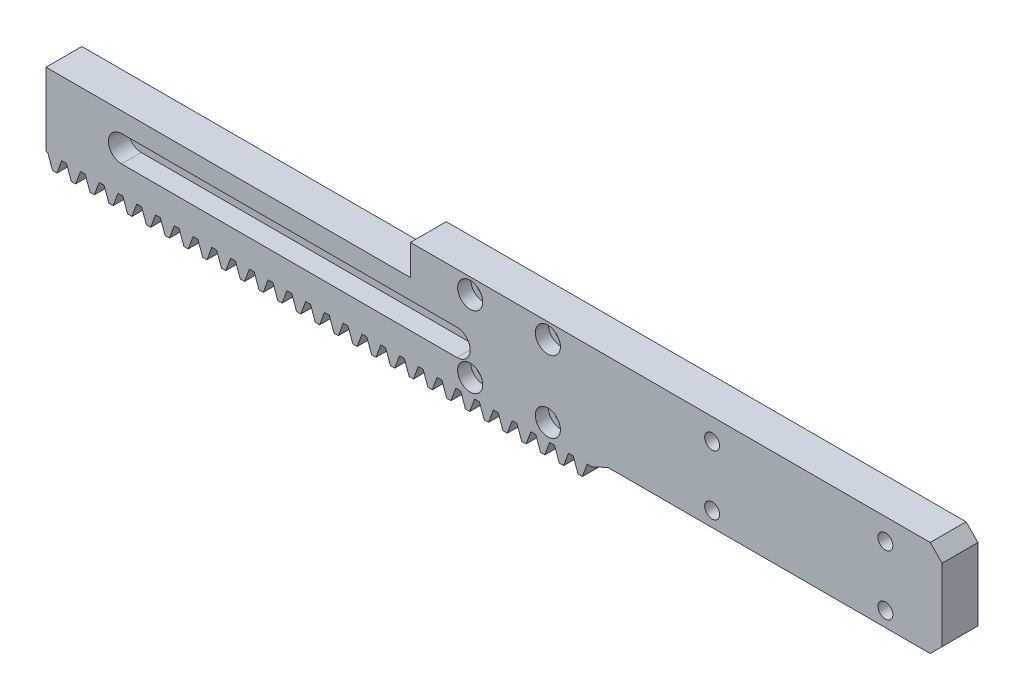
from build123d import *

# Parameters (mm, degrees)
MODULE_START                                   = 40.4
MODULE_1_RACK_WITH_VERTICAL_CARRIER_TAIL_DEPTH = 6
MGN7H_START                                    = 40.4
MGN7H_CARRIAGE_FIXING_PAD_PROFILE_W            = 33
MGN7H_CARRIAGE_FIXING_PAD_PROFILE_H            = 6.1
MGN7H_CARRIAGE_FIXING_PAD_DEPTH                = 6
FULL_START                                     = 43.1
FULL_STROKE_LIMIT_SLOT_56_55_MM_DEPTH          = 3.4
RADAR_START                                    = 40.3
RADAR_SEAT_FOUR_M3_PILOTS_29_X_10_MM_PRO_R     = 1.25
RADAR_SEAT_FOUR_M3_PILOTS_29_X_10_MM_DEPTH     = 6.2
MGN7H_START_2                                  = 40.3
MGN7H_FOUR_M2_CLEARANCES_13_X_12_MM_PROF_R     = 1.1
MGN7H_FOUR_M2_CLEARANCES_13_X_12_MM_DEPTH      = 6.2
MGN7H_START_3                                  = 44.2
MGN7H_M2_HEAD_POCKETS_PROFILE_R                = 2.1
MGN7H_M2_HEAD_POCKETS_DEPTH                    = 2.3


with BuildPart() as part:
    # Module 1 rack with vertical carrier  2 → Module 1 rack with vertical carrier tail (new body)
    with BuildSketch(Plane.XY.offset(MODULE_START)):
        Polygon((-69, 10.26), (-68.713242711, 10.26), (-67.908868493, 8.05), (-67.179615611, 8.05), (-66.375241394, 10.26), (-65.571650057, 10.26), (-64.767275839, 8.05), (-64.038022958, 8.05), (-63.23364874, 10.26), (-62.430057404, 10.26), (-61.625683186, 8.05), (-60.896430304, 8.05), (-60.092056086, 10.26), (-59.28846475, 10.26), (-58.484090532, 8.05), (-57.754837651, 8.05), (-56.950463433, 10.26), (-56.146872096, 10.26), (-55.342497879, 8.05), (-54.613244997, 8.05), (-53.808870779, 10.26), (-53.005279443, 10.26), (-52.200905225, 8.05), (-51.471652343, 8.05), (-50.667278126, 10.26), (-49.863686789, 10.26), (-49.059312572, 8.05), (-48.33005969, 8.05), (-47.525685472, 10.26), (-46.722094136, 10.26), (-45.917719918, 8.05), (-45.188467036, 8.05), (-44.384092819, 10.26), (-43.580501482, 10.26), (-42.776127264, 8.05), (-42.046874383, 8.05), (-41.242500165, 10.26), (-40.438908828, 10.26), (-39.634534611, 8.05), (-38.905281729, 8.05), (-38.100907511, 10.26), (-37.297316175, 10.26), (-36.492941957, 8.05), (-35.763689075, 8.05), (-34.959314858, 10.26), (-34.155723521, 10.26), (-33.351349304, 8.05), (-32.622096422, 8.05), (-31.817722204, 10.26), (-31.014130868, 10.26), (-30.20975665, 8.05), (-29.480503768, 8.05), (-28.676129551, 10.26), (-27.872538214, 10.26), (-27.068163996, 8.05), (-26.338911115, 8.05), (-25.534536897, 10.26), (-24.730945561, 10.26), (-23.926571343, 8.05), (-23.197318461, 8.05), (-22.392944243, 10.26), (-21.589352907, 10.26), (-20.784978689, 8.05), (-20.055725808, 8.05), (-19.25135159, 10.26), (-18.447760253, 10.26), (-17.643386036, 8.05), (-16.914133154, 8.05), (-16.109758936, 10.26), (-15.3061676, 10.26), (-14.501793382, 8.05), (-13.7725405, 8.05), (-12.968166283, 10.26), (-12.164574946, 10.26), (-11.360200728, 8.05), (-10.630947847, 8.05), (-9.826573629, 10.26), (-9.022982293, 10.26), (-8.218608075, 8.05), (-7.489355193, 8.05), (-6.684980975, 10.26), (-5.881389639, 10.26), (-5.077015421, 8.05), (-4.34776254, 8.05), (-3.543388322, 10.26), (-2.739796985, 10.26), (-1.935422768, 8.05), (-1.206169886, 8.05), (-0.401795668, 10.26), (0.401795668, 10.26), (1.206169886, 8.05), (1.935422768, 8.05), (2.739796985, 10.26), (3.543388322, 10.26), (4.34776254, 8.05), (5.077015421, 8.05), (5.881389639, 10.26), (6.684980975, 10.26), (7.489355193, 8.05), (8.218608075, 8.05), (9.022982293, 10.26), (9.826573629, 10.26), (10.630947847, 8.05), (11.360200728, 8.05), (12.164574946, 10.26), (12.968166283, 10.26), (13.7725405, 8.05), (14.501793382, 8.05), (15.3061676, 10.26), (16.109758936, 10.26), (16.914133154, 8.05), (17.643386036, 8.05), (18.447760253, 10.26), (19.25135159, 10.26), (20.055725808, 8.05), (20.784978689, 8.05), (21.589352907, 10.26), (22.5, 10.26), (25, 11.5), (79, 11.5), (81, 13.5), (81, 25.6), (79, 27.6), (22.5, 27.6), (22.5, 22.5), (-69, 22.5), align=None)
    extrude(amount=MODULE_1_RACK_WITH_VERTICAL_CARRIER_TAIL_DEPTH)

    # MGN7H carriage fixing pad profile → MGN7H carriage fixing pad (add)
    with BuildSketch(Plane.XY.offset(MGN7H_START)):
        with Locations((8.5, 24.55)):
            Rectangle(MGN7H_CARRIAGE_FIXING_PAD_PROFILE_W, MGN7H_CARRIAGE_FIXING_PAD_PROFILE_H)
    extrude(amount=MGN7H_CARRIAGE_FIXING_PAD_DEPTH)

    # Full stroke limit slot 56.55 mm profile → Full stroke limit slot 56.55 mm (cut)
    with BuildSketch(Plane.XY.offset(FULL_START)):
        with BuildLine():
            Line((-56.348667765, 14.8), (-0.2, 14.8))
            ThreePointArc((-0.2, 14.8), (2, 17), (-0.2, 19.2))
            Line((-0.2, 19.2), (-56.348667765, 19.2))
            ThreePointArc((-56.348667765, 19.2), (-58.548667765, 17), (-56.348667765, 14.8))
        make_face()
    extrude(amount=FULL_STROKE_LIMIT_SLOT_56_55_MM_DEPTH, mode=Mode.SUBTRACT)

    # Radar seat four M3 pilots 29 x 10 mm profile → Radar seat four M3 pilots 29 x 10 mm (cut)
    with BuildSketch(Plane.XY.offset(RADAR_START)):
        with Locations(Location((42.5, 14, 0), (0, 0, 180))):
            Circle(RADAR_SEAT_FOUR_M3_PILOTS_29_X_10_MM_PRO_R)
        with Locations(Location((42.5, 24, 0), (0, 0, 180))):
            Circle(RADAR_SEAT_FOUR_M3_PILOTS_29_X_10_MM_PRO_R)
        with Locations(Location((71.5, 14, 0), (0, 0, 180))):
            Circle(RADAR_SEAT_FOUR_M3_PILOTS_29_X_10_MM_PRO_R)
        with Locations(Location((71.5, 24, 0), (0, 0, 180))):
            Circle(RADAR_SEAT_FOUR_M3_PILOTS_29_X_10_MM_PRO_R)
    extrude(amount=RADAR_SEAT_FOUR_M3_PILOTS_29_X_10_MM_DEPTH, mode=Mode.SUBTRACT)

    # MGN7H four M2 clearances 13 x 12 mm profile → MGN7H four M2 clearances 13 x 12 mm (cut)
    with BuildSketch(Plane.XY.offset(MGN7H_START_2)):
        with Locations(Location((2, 13, 0), (0, 0, 180))):
            Circle(MGN7H_FOUR_M2_CLEARANCES_13_X_12_MM_PROF_R)
        with Locations(Location((2, 25, 0), (0, 0, 180))):
            Circle(MGN7H_FOUR_M2_CLEARANCES_13_X_12_MM_PROF_R)
        with Locations(Location((15, 13, 0), (0, 0, 180))):
            Circle(MGN7H_FOUR_M2_CLEARANCES_13_X_12_MM_PROF_R)
        with Locations(Location((15, 25, 0), (0, 0, 180))):
            Circle(MGN7H_FOUR_M2_CLEARANCES_13_X_12_MM_PROF_R)
    extrude(amount=MGN7H_FOUR_M2_CLEARANCES_13_X_12_MM_DEPTH, mode=Mode.SUBTRACT)

    # MGN7H M2 head pockets profile → MGN7H M2 head pockets (cut)
    with BuildSketch(Plane.XY.offset(MGN7H_START_3)):
        with Locations((2, 13)):
            Circle(MGN7H_M2_HEAD_POCKETS_PROFILE_R)
        with Locations((2, 25)):
            Circle(MGN7H_M2_HEAD_POCKETS_PROFILE_R)
        with Locations((15, 13)):
            Circle(MGN7H_M2_HEAD_POCKETS_PROFILE_R)
        with Locations((15, 25)):
            Circle(MGN7H_M2_HEAD_POCKETS_PROFILE_R)
    extrude(amount=MGN7H_M2_HEAD_POCKETS_DEPTH, mode=Mode.SUBTRACT)


solid = part.part
